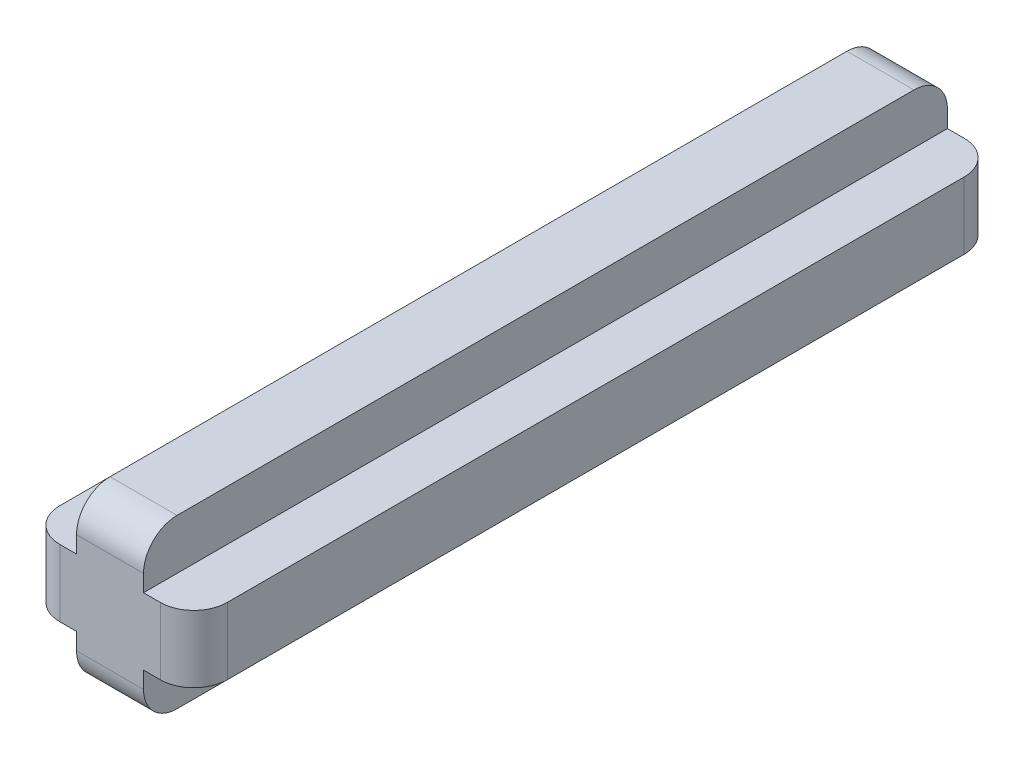
from build123d import *

# Parameters (mm, degrees)
SKETCH1_W           = 5
SKETCH1_H           = 5
BOSS_EXTRUDE1_DEPTH = 24
SKETCH2_W           = 1.5
SKETCH2_H           = 1.5
CUT_EXTRUDE1_DEPTH  = 26.019992006
FILLET1_R           = 1
FILLET2_R           = 1


with BuildPart() as part:
    # Sketch1 → Boss-Extrude1 (new body)
    with BuildSketch(Plane.XY):
        with Locations((2.5, 2.5)):
            Rectangle(SKETCH1_W, SKETCH1_H)
    extrude(amount=BOSS_EXTRUDE1_DEPTH)

    # Sketch2 → Cut-Extrude1 (cut, through all)
    with BuildSketch(Plane.XY.offset(24)):
        with Locations((0.75, 4.25)):
            Rectangle(SKETCH2_W, SKETCH2_H)
        with Locations((4.25, 4.25)):
            Rectangle(SKETCH2_W, SKETCH2_H)
        with Locations((4.25, 0.75)):
            Rectangle(SKETCH2_W, SKETCH2_H)
        with Locations((0.75, 0.75)):
            Rectangle(SKETCH2_W, SKETCH2_H)
    extrude(amount=-CUT_EXTRUDE1_DEPTH, mode=Mode.SUBTRACT)

    # Fillet1
    fillet1_edges = [part.edges().sort_by_distance(p)[0] for p in [
        (0, 2.5, 24),
        (2.5, 5, 24),
        (5, 2.5, 24),
        (2.5, 0, 24),
    ]]
    fillet(fillet1_edges, radius=FILLET1_R)

    # Fillet2
    fillet2_edges = [part.edges().sort_by_distance(p)[0] for p in [
        (0, 2.5, 0),
        (2.5, 5, 0),
        (5, 2.5, 0),
        (2.5, 0, 0),
    ]]
    fillet(fillet2_edges, radius=FILLET2_R)


solid = part.part
